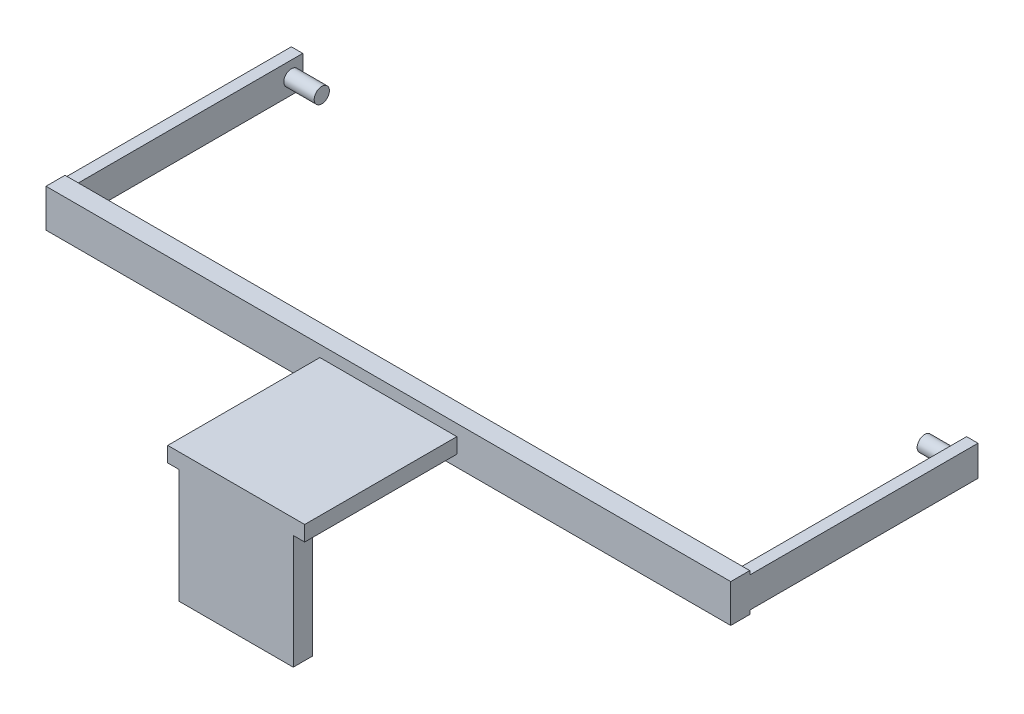
from build123d import *

# Parameters (mm, degrees)
SKETCH_1_W             = 180
SKETCH_1_H             = 5
EXTRUDE_1_DEPTH        = 10
SKETCH_2_W             = 3
SKETCH_2_H             = 8
EXTRUDE_2_DEPTH        = 60
SKETCH_5_R             = 2
EXTRUDE_4_DEPTH        = 8
SKETCH_6_W             = 36
SKETCH_6_H             = 4
EXTRUDE_5_DEPTH        = 40
SKETCH_7_W             = 30
SKETCH_7_H             = 5
EXTRUDE_6_DEPTH        = 30
PATTERN_LINEAR_1_COUNT = 2
PATTERN_LINEAR_1_PITCH = 177.5
EXTRUDE_START          = 8
SKETCH_8_R             = 2
EXTRUDE_7_DEPTH        = 8


with BuildPart() as part:
    # 草图1 → 凸台-拉伸1 (new body)
    with BuildSketch(Plane(origin=(0, 0, 0), x_dir=(1, 0, 0), z_dir=(0, 1, 0))):
        Rectangle(SKETCH_1_W, SKETCH_1_H)
    extrude(amount=EXTRUDE_1_DEPTH)

    # 草图2 → 凸台-拉伸2 (add)
    with BuildSketch(Plane(origin=(0, 0, -2.5), x_dir=(-1, 0, 0), z_dir=(0, 0, -1))):
        with Locations((-88.5, 5)):
            Rectangle(SKETCH_2_W, SKETCH_2_H)
    extrude_2 = extrude(amount=EXTRUDE_2_DEPTH)

    # 草图5 → 凸台-拉伸4 (add)
    with BuildSketch(Plane.ZY.offset(-87)):
        with Locations(Location((-59.5, 5, 0), (0, 0, 180))):
            Circle(SKETCH_5_R)
    extrude(amount=EXTRUDE_4_DEPTH)

    # 草图6 → 凸台-拉伸5 (add)
    with BuildSketch(Plane.XY.offset(2.5)):
        with Locations((0, 5)):
            Rectangle(SKETCH_6_W, SKETCH_6_H)
    extrude(amount=EXTRUDE_5_DEPTH)

    # 草图7 → 凸台-拉伸6 (add)
    with BuildSketch(Plane.XZ.offset(-3)):
        with Locations((0, 40)):
            Rectangle(SKETCH_7_W, SKETCH_7_H)
    extrude(amount=EXTRUDE_6_DEPTH)

    # 阵列(线性)1: 凸台-拉伸2 ×2
    with Locations(*[(-i * PATTERN_LINEAR_1_PITCH, 0, 0) for i in range(1, PATTERN_LINEAR_1_COUNT)]):
        add(extrude_2)

    # 草图8 → 凸台-拉伸7 (add)
    with BuildSketch(Plane(origin=(-87.5, 0, 0), x_dir=(0, 0, -1), z_dir=(1, 0, 0)).offset(EXTRUDE_START)):
        with Locations((59.5, 5)):
            Circle(SKETCH_8_R)
    extrude(amount=-EXTRUDE_7_DEPTH)


solid = part.part
